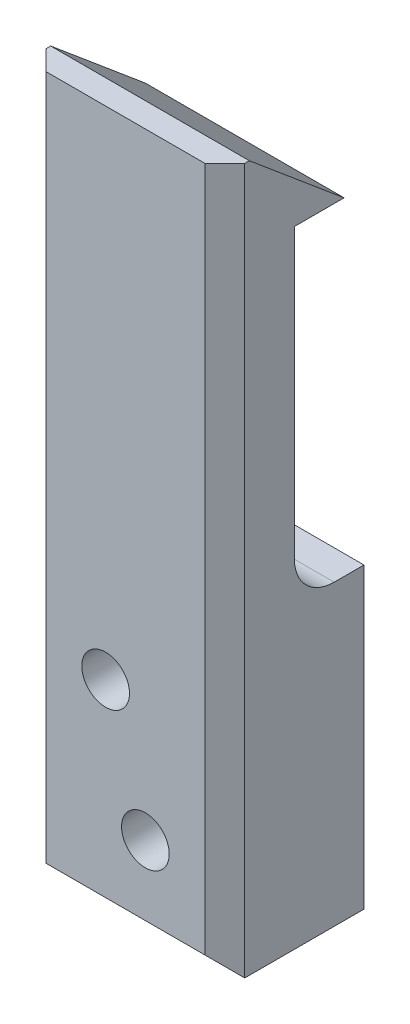
from build123d import *

# Parameters (mm, degrees)
EXTRUDE_1_DEPTH    = 10
HOLE_WIZARD_M2_1_D = 2.4
CHAMFER_1_SIZE     = 1


with BuildPart() as part:
    # 草图3 → 凸台-拉伸1 (new body)
    with BuildSketch(Plane(origin=(3, 0, 0), x_dir=(0, 0, -1), z_dir=(1, 0, 0))):
        with BuildLine():
            Line((-7, -31), (0, -31))
            Line((0, -31), (0, -16))
            Line((0, -16), (-1.5, -16))
            ThreePointArc((-1.5, -16), (-2.914213562, -15.414213562), (-3.5, -14))
            Line((-3.5, -14), (-3.5, 0.5))
            Line((-3.5, 0.5), (-1, 0.5))
            Line((-1, 0.5), (-5.76701437, 4.5))
            Line((-5.76701437, 4.5), (-7, 4.5))
            Line((-7, 4.5), (-7, -31))
        make_face()
    extrude(amount=-EXTRUDE_1_DEPTH)

    # M2 间隙孔1 (through all)
    with Locations(Plane.XY.offset(7)):
        with Locations((-1, -26.5), (-3, -20.5)):
            Hole(HOLE_WIZARD_M2_1_D / 2)

    # 倒角1
    chamfer_1_edges = [part.edges().sort_by_distance(p)[0] for p in [
        (3, -13.25, 7),
        (-2, -31, 7),
        (-7, -13.25, 7),
    ]]
    chamfer(chamfer_1_edges, length=CHAMFER_1_SIZE)


solid = part.part
